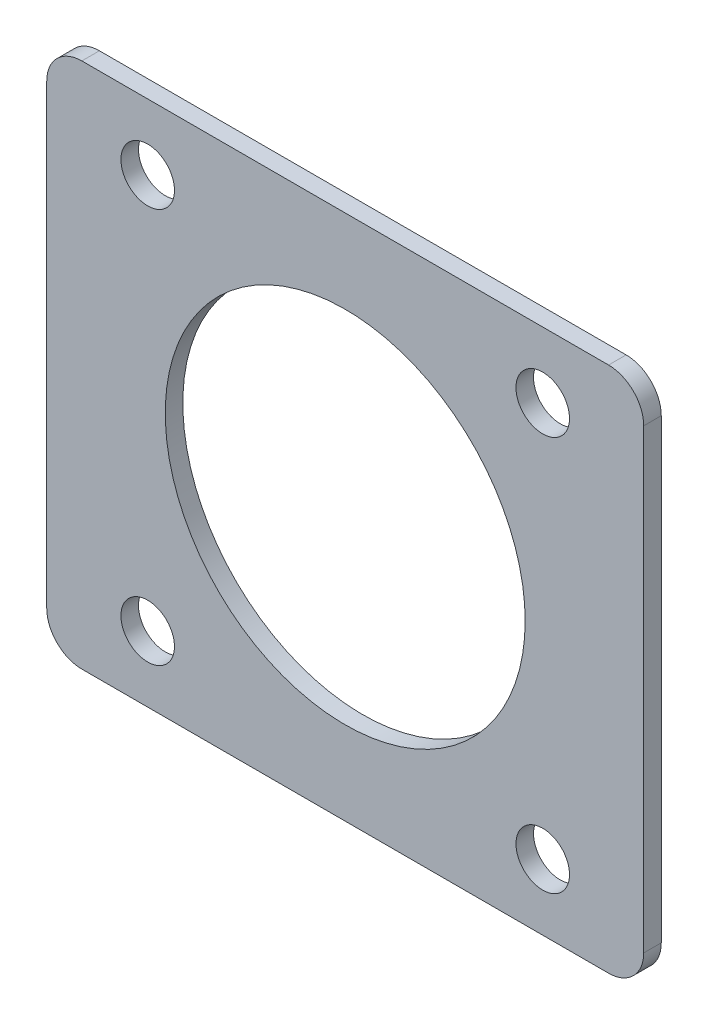
from build123d import *

# Parameters (mm, degrees)
SKETCH1_R           = 3.05
SKETCH1_R_2         = 20.5
BOSS_EXTRUDE1_DEPTH = 2


with BuildPart() as part:
    # Sketch1 → Boss-Extrude1 (new body)
    with BuildSketch(Plane.XY):
        with BuildLine():
            Line((-30, 30), (30, 30))
            ThreePointArc((30, 30), (32.828427125, 28.828427125), (34, 26))
            Line((34, 26), (34, -26))
            ThreePointArc((34, -26), (32.828427125, -28.828427125), (30, -30))
            Line((30, -30), (-30, -30))
            ThreePointArc((-30, -30), (-32.828427125, -28.828427125), (-34, -26))
            Line((-34, -26), (-34, 26))
            ThreePointArc((-34, 26), (-32.828427125, 28.828427125), (-30, 30))
        make_face()
        with Locations((22.5, -22.5)):
            Circle(SKETCH1_R, mode=Mode.SUBTRACT)
        with Locations(Location((-22.5, -22.5, 0), (0, 0, 180))):
            Circle(SKETCH1_R, mode=Mode.SUBTRACT)
        with Locations((-22.5, 22.5)):
            Circle(SKETCH1_R, mode=Mode.SUBTRACT)
        with Locations(Location((22.5, 22.5, 0), (0, 0, 180))):
            Circle(SKETCH1_R, mode=Mode.SUBTRACT)
        Circle(SKETCH1_R_2, mode=Mode.SUBTRACT)
    extrude(amount=BOSS_EXTRUDE1_DEPTH)


solid = part.part
